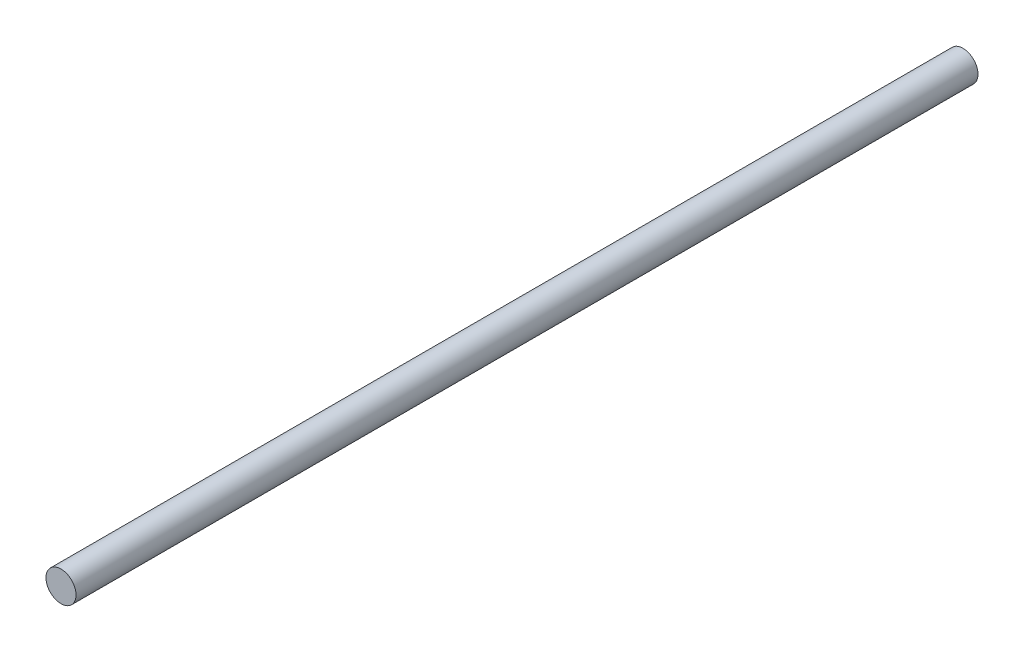
from build123d import *

# Parameters (mm, degrees)
SKETCH1_R           = 12.5
BOSS_EXTRUDE1_DEPTH = 750


with BuildPart() as part:
    # Sketch1 → Boss-Extrude1 (new body)
    with BuildSketch(Plane.XY):
        Circle(SKETCH1_R)
    extrude(amount=BOSS_EXTRUDE1_DEPTH)


solid = part.part
